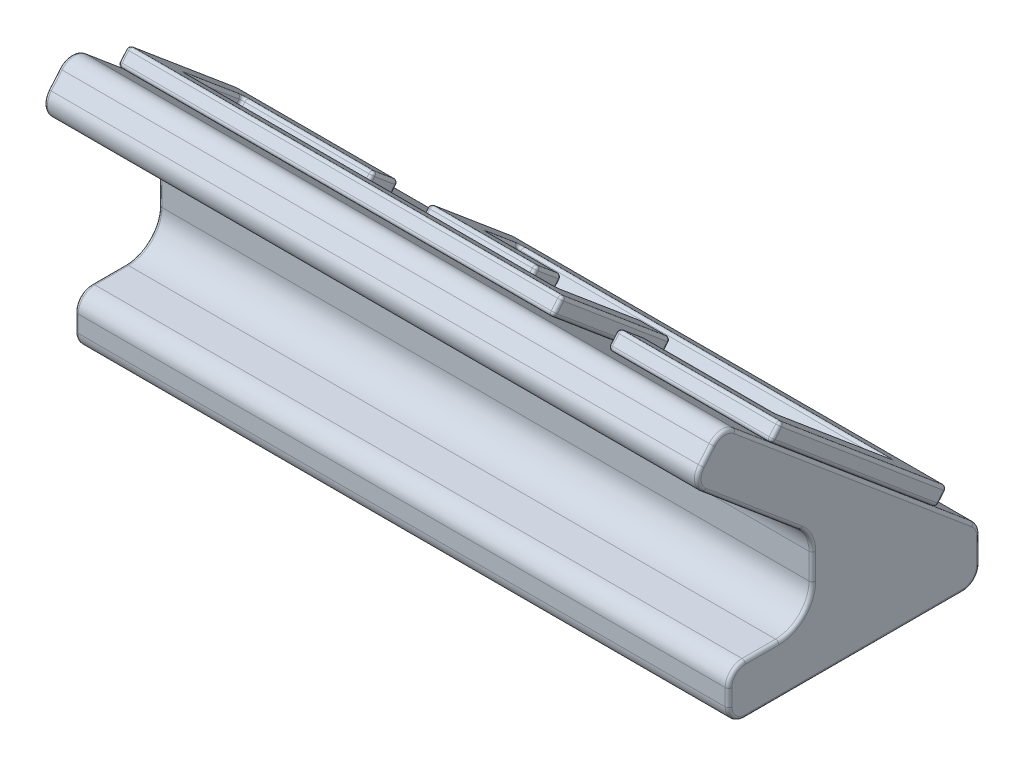
from build123d import *

# Parameters (mm, degrees)
BOSS_EXTRUDE1_DEPTH   = 39
FILLET1_R             = 1
FILLET2_R             = 2
BOSS_EXTRUDE2_DEPTH   = 1
BOSS_EXTRUDE2_2_DEPTH = 1
FILLET3_R             = 0.2
FILLET4_R             = 0.2
FILLET5_R             = 0.2


with BuildPart() as part:
    # Sketch2 → Boss-Extrude1 (new body)
    with BuildSketch(Plane(origin=(0, 0, 0), x_dir=(0, 0, -1), z_dir=(1, 0, 0))):
        Polygon((0, 0), (15, 0), (15, 3), (-0.320888862, 15.855752194), (-2.249251691, 13.557618864), (5, 7.474774444), (5, 3), (0, 3), align=None)
    extrude(amount=BOSS_EXTRUDE1_DEPTH)

    # Fillet1
    fillet1_edges = [part.edges().sort_by_distance(p)[0] for p in [
        (19.5, 3, 0),
        (19.5, 13.557618864, 2.249251691),
        (19.5, 15.855752194, 0.320888862),
        (19.5, 3, -15),
        (19.5, 0, -15),
        (19.5, 0, 0),
    ]]
    fillet(fillet1_edges, radius=FILLET1_R)

    # Fillet2
    fillet2_edges = [part.edges().sort_by_distance(p)[0] for p in [
        (19.5, 3, -5),
        (19.5, 7.474774444, -5),
    ]]
    fillet(fillet2_edges, radius=FILLET2_R)

    # Fillet3
    fillet3_edges = [part.edges().sort_by_distance(p)[0] for p in [
        (0, 1.5, 0),
        (39, 1.5, 0),
        (0, 10.494539634, -1.401183986),
        (0, 14.706685529, 1.285070277),
        (0, 9.256350685, -7.543971595),
        (0, 1.766846171, -15),
        (0, 0, -7.5),
        (0, 2.956310604, -14.906307787),
        (0, 0.292893219, -14.707106781),
        (0, 15.443114839, 0.284787772),
        (0, 13.593719955, 1.836614337),
        (0, 0.292893219, -0.292893219),
        (0, 2.707106781, -0.292893219),
        (39, 0, -7.5),
        (39, 1.766846171, -15),
        (39, 9.256350685, -7.543971595),
        (39, 14.706685529, 1.285070277),
        (39, 10.494539634, -1.401183986),
        (39, 2.956310604, -14.906307787),
        (39, 0.292893219, -14.707106781),
        (39, 15.443114839, 0.284787772),
        (39, 13.593719955, 1.836614337),
        (39, 0.292893219, -0.292893219),
        (39, 2.707106781, -0.292893219),
        (0, 5.771079564, -5),
        (39, 5.771079564, -5),
        (0, 3, -2),
        (39, 3, -2),
        (0, 7.387395651, -4.812615574),
        (39, 7.387395651, -4.812615574),
        (0, 3.585786438, -4.414213562),
        (39, 3.585786438, -4.414213562),
    ]]
    fillet(fillet3_edges, radius=FILLET3_R)


with BuildPart() as body_2:
    # Sketch3 → Boss-Extrude2 (new body)
    with BuildSketch(Plane(origin=(0, 9.146530414, -7.674850297), x_dir=(1, 0, 0), z_dir=(0, 0.7660444431189817, -0.642787609686535))):
        Polygon((25.983181194, -6.739768559), (25.983181194, 1.710231441), (24.033181194, 1.710231441), (24.033181194, -4.789768559), (1.933181194, -4.789768559), (1.933181194, -0.239768559), (9.733181194, -0.239768559), (9.733181194, 1.710231441), (-0.016818806, 1.710231441), (-0.016818806, -6.739768559), align=None)
    extrude(amount=BOSS_EXTRUDE2_DEPTH)

    # Fillet5
    fillet5_edges = [body_2.edges().sort_by_distance(p)[0] for p in [
        (25.008181194, 8.813259277, -9.627751198),
        (9.733181194, 8.673932754, -8.238070257),
        (5.833181194, 9.300650673, -7.491176925),
        (1.933181194, 10.762992485, -5.748425817),
        (12.983181194, 12.225334297, -4.005674709),
        (24.033181194, 10.136274566, -6.495319149),
        (25.008181194, 8.047214834, -8.984963589),
        (25.983181194, 10.762992485, -5.748425817),
        (12.983181194, 13.478770136, -2.511888044),
        (24.033181194, 10.902319009, -7.138106758),
        (12.983181194, 12.99137874, -4.648462318),
        (-0.016818806, 13.861792358, -2.833281849),
        (-0.016818806, 8.430237056, -9.306357394),
        (9.733181194, 8.430237056, -9.306357394),
        (9.733181194, 9.683672895, -7.81257073),
        (1.933181194, 9.683672895, -7.81257073),
        (1.933181194, 12.608356519, -4.327068513),
        (24.033181194, 12.608356519, -4.327068513),
        (24.033181194, 8.430237056, -9.306357394),
        (25.983181194, 8.430237056, -9.306357394),
        (25.983181194, 13.861792358, -2.833281849),
        (1.933181194, 11.529036928, -6.391213426),
        (5.833181194, 10.066695116, -8.133964534),
        (9.733181194, 9.439977197, -8.880857866),
        (4.858181194, 8.813259277, -9.627751198),
        (-0.016818806, 11.529036928, -6.391213426),
        (12.983181194, 14.244814579, -3.154675654),
        (25.983181194, 11.529036928, -6.391213426),
        (-0.016818806, 10.762992485, -5.748425817),
        (4.858181194, 8.047214834, -8.984963589),
    ]]
    fillet(fillet5_edges, radius=FILLET5_R)


with BuildPart() as body_3:
    # Sketch3 → Boss-Extrude2 2 (new body)
    with BuildSketch(Plane(origin=(0, 9.146530414, -7.674850297), x_dir=(1, 0, 0), z_dir=(0, 0.7660444431189817, -0.642787609686535))):
        Polygon((38.983181194, -6.739768559), (38.983181194, 6.260231441), (12.983181194, 6.260231441), (12.983181194, -0.239768559), (19.483181194, -0.239768559), (19.483181194, 1.710231441), (14.933181194, 1.710231441), (14.933181194, 4.310231441), (37.033181194, 4.310231441), (37.033181194, -4.789768559), (29.233181194, -4.789768559), (29.233181194, -6.739768559), align=None)
    extrude(amount=BOSS_EXTRUDE2_2_DEPTH)

    # Fillet4
    fillet4_edges = [body_3.edges().sort_by_distance(p)[0] for p in [
        (25.983181194, 5.888575653, -13.113253415),
        (29.233181194, 12.852052217, -3.258781376),
        (33.133181194, 12.225334297, -4.005674709),
        (37.033181194, 9.300650673, -7.491176925),
        (25.983181194, 6.375967049, -10.976679141),
        (14.933181194, 7.211590942, -9.980821365),
        (17.208181194, 8.047214834, -8.984963589),
        (12.983181194, 7.977635385, -10.623608975),
        (19.483181194, 8.673932754, -8.238070257),
        (16.233181194, 9.300650673, -7.491176925),
        (12.983181194, 7.211590942, -9.980821365),
        (25.983181194, 5.12253121, -12.470465805),
        (38.983181194, 9.300650673, -7.491176925),
        (34.108181194, 13.478770136, -2.511888044),
        (16.233181194, 10.066695116, -8.133964534),
        (19.483181194, 9.439977197, -8.880857866),
        (29.233181194, 13.861792358, -2.833281849),
        (29.233181194, 12.608356519, -4.327068513),
        (37.033181194, 12.608356519, -4.327068513),
        (37.033181194, 6.758989271, -11.298072946),
        (14.933181194, 6.758989271, -11.298072946),
        (14.933181194, 8.430237056, -9.306357394),
        (19.483181194, 8.430237056, -9.306357394),
        (19.483181194, 9.683672895, -7.81257073),
        (12.983181194, 9.683672895, -7.81257073),
        (12.983181194, 5.505553432, -12.79185961),
        (38.983181194, 5.505553432, -12.79185961),
        (38.983181194, 13.861792358, -2.833281849),
        (17.208181194, 8.813259277, -9.627751198),
        (14.933181194, 7.977635385, -10.623608975),
        (25.983181194, 7.142011492, -11.619466751),
        (37.033181194, 10.066695116, -8.133964534),
        (33.133181194, 12.99137874, -4.648462318),
        (29.233181194, 13.61809666, -3.901568986),
        (34.108181194, 14.244814579, -3.154675654),
        (38.983181194, 10.066695116, -8.133964534),
    ]]
    fillet(fillet4_edges, radius=FILLET4_R)


solid = Compound([part.part, body_2.part, body_3.part])
